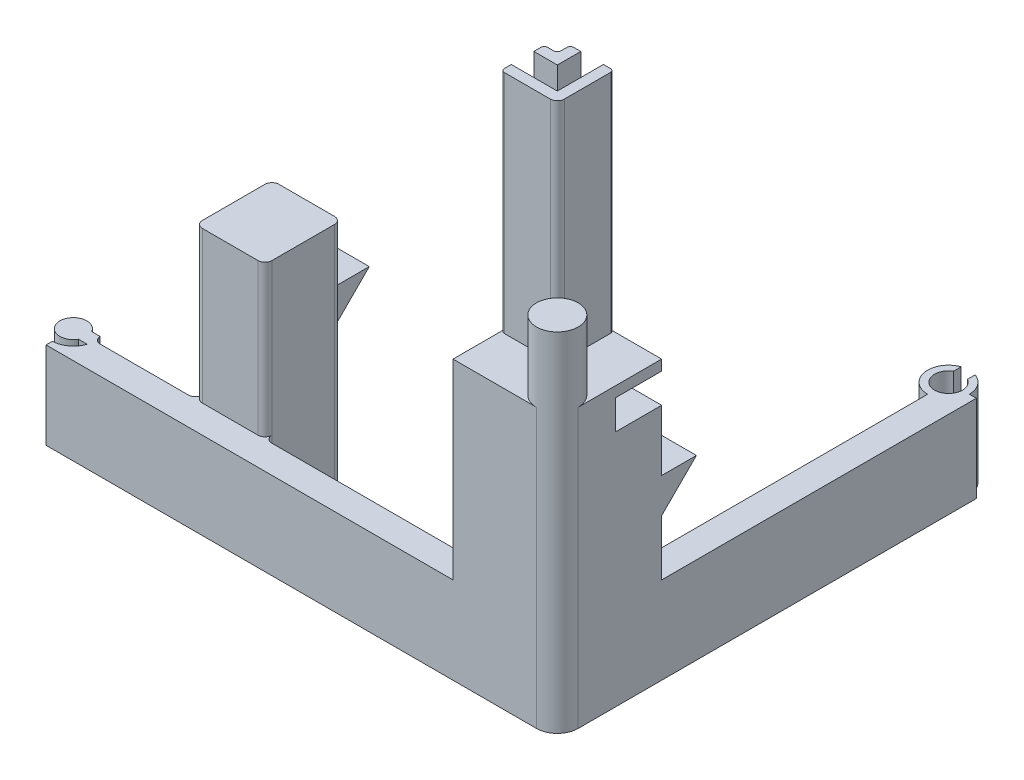
from build123d import *
from build123d.topology import SkipClean

# Parameters (mm, degrees)
SKETCH1_W                 = 30
SKETCH1_H                 = 30
BOSS_EXTRUDE1_DEPTH       = 80
SKETCH2_R                 = 6
BOSS_EXTRUDE2_DEPTH       = 20
CUT_EXTRUDE1_DEPTH        = 83.764726786
BOSS_EXTRUDE3_DEPTH       = 65
BOSS_EXTRUDE5_DEPTH       = 2
BOSS_EXTRUDE6_DEPTH       = 23
BOSS_EXTRUDE7_DEPTH       = 25
FILLET1_R                 = 2
SKETCH11_R                = 6.055782361
CUT_EXTRUDE2_DEPTH        = 2.125
CUT_EXTRUDE3_DEPTH        = 238.220050797
CUT_EXTRUDE3_DEPTH_BACK   = 238.220050797
SKETCH12_W                = 13.25
SKETCH12_H                = 8.5
FILLET2_R                 = 2
CUT_EXTRUDE4_REACH        = 195.24
SKETCH15_W                = 3.75
SKETCH15_H                = 3.75
FILLET3_R                 = 1
BOSS_EXTRUDE8_REACH       = 229.962
SKETCH16_W                = 20
SKETCH16_H                = 22
FILLET4_R                 = 2
FILLET5_R                 = 2
SKETCH17_W                = 15
SKETCH17_H                = 17
CUT_EXTRUDE5_DEPTH        = 66
CHAMFER1_SIZE             = 7
BOSS_EXTRUDE9_DEPTH       = 30
BOSS_EXTRUDE10_DEPTH      = 7.999995
BOSS_EXTRUDE10_DEPTH_BACK = 8.000005


with BuildPart() as part:
    # Sketch1 → Boss-Extrude1 (new body)
    with BuildSketch(Plane(origin=(0, 0, 0), x_dir=(1, 0, 0), z_dir=(0, 1, 0))):
        Rectangle(SKETCH1_W, SKETCH1_H)
    extrude(amount=BOSS_EXTRUDE1_DEPTH)

    # Sketch2 → Boss-Extrude2 (add)
    with BuildSketch(Plane(origin=(0, 80, 0), x_dir=(1, 0, 0), z_dir=(0, 1, 0))):
        with Locations(Location((9, -9, 0), (0, 0, 270))):
            Circle(SKETCH2_R)
    extrude(amount=BOSS_EXTRUDE2_DEPTH)

    # Sketch3 → Cut-Extrude1 (cut, through all)
    with BuildSketch(Plane(origin=(0, 80, 0), x_dir=(1, 0, 0), z_dir=(0, 1, 0))):
        with BuildLine():
            Line((9, -15), (15, -15))
            Line((15, -15), (15, -9))
            ThreePointArc((15, -9), (13.242640687, -13.242640687), (9, -15))
        make_face()
    extrude(amount=-CUT_EXTRUDE1_DEPTH, mode=Mode.SUBTRACT)

    # Sketch4 → Boss-Extrude3 (add)
    with BuildSketch(Plane(origin=(0, 80, 0), x_dir=(1, 0, 0), z_dir=(0, 1, 0))):
        Polygon((1.25, 11.25), (1.25, 15), (-1.75, 15), (-1.75, 11.25), (-1.75, 1.75), (-11.25, 1.75), (-15, 1.75), (-15, -1.25), (-11.25, -1.25), (1.25, -1.25), align=None)
        Polygon((-8.25, 11.25), (-8.25, 8.25), (-11.25, 8.25), (-15, 8.25), (-15, 11.25), (-11.25, 11.25), (-11.25, 15), (-8.25, 15), align=None)
    extrude(amount=BOSS_EXTRUDE3_DEPTH)

    # Sketch6 → Boss-Extrude5 (add)
    with BuildSketch(Plane.XZ):
        with BuildLine():
            Line((15, -15), (7, -15))
            Line((7, -15), (7, -99.5))
            ThreePointArc((7, -99.5), (2.757359313, -109.742640687), (13, -105.5))
            Line((13, -105.5), (15, -105.5))
            Line((15, -105.5), (15, -15))
        make_face()
    extrude(amount=-BOSS_EXTRUDE5_DEPTH)

    # Sketch7 → Boss-Extrude6 (add)
    with SkipClean():  # the faces are left unmerged after this step: merging them gives an invalid solid
        with BuildSketch(Plane(origin=(0, 2, 0), x_dir=(1, 0, 0), z_dir=(0, 1, 0))):
            with BuildLine():
                Line((9, 111.156854249), (9, 108.964101615))
                ThreePointArc((9, 108.964101615), (7, 101.5), (5, 108.964101615))
                Line((5, 108.964101615), (5, 111.156854249))
                ThreePointArc((5, 111.156854249), (1.086408642, 104.485388128), (7, 99.5))
                Line((7, 99.5), (7, 15))
                Line((7, 15), (15, 15))
                Line((15, 15), (15, 105.5))
                Line((15, 105.5), (13, 105.5))
                ThreePointArc((13, 105.5), (11.898979486, 108.964101615), (9, 111.156854249))
            make_face()
        extrude(amount=BOSS_EXTRUDE6_DEPTH)

    # Sketch9 → Boss-Extrude7 (add)
    with SkipClean():  # the faces are left unmerged after this step: merging them gives an invalid solid
        with BuildSketch(Plane.XZ):
            with BuildLine():
                Line((-15, 15), (-15, 7))
                Line((-15, 7), (-126.175, 7))
                ThreePointArc((-126.175, 7), (-126.252697751, 6.037536458), (-126.48377869, 5.1))
                Line((-126.48377869, 5.1), (-128.797778509, 5.1))
                ThreePointArc((-128.797778509, 5.1), (-136.05, 7), (-128.797778509, 8.9))
                Line((-128.797778509, 8.9), (-126.3, 8.9))
                ThreePointArc((-126.3, 8.9), (-128.491885554, 11.955834237), (-132.050001601, 13.173329766))
                Line((-132.050001601, 13.173329766), (-132.050001601, 15))
                Line((-132.050001601, 15), (-15, 15))
            make_face()
        extrude(amount=-BOSS_EXTRUDE7_DEPTH)

    # Fillet1
    fillet1_edges = [part.edges().sort_by_distance(p)[0] for p in [
        (-126.175, 12.5, 7),
    ]]
    fillet(fillet1_edges, radius=FILLET1_R)

    # Sketch11 → Cut-Extrude2 (cut)
    with SkipClean():  # the faces are left unmerged after this step: merging them gives an invalid solid
        with BuildSketch(Plane.XZ):
            with Locations((-132.175, 7)):
                Circle(SKETCH11_R)
        extrude(amount=-CUT_EXTRUDE2_DEPTH, mode=Mode.SUBTRACT)

    # Sketch12 → Cut-Extrude3 (cut, two sides: drawn at the far end of the back side and taken through both)
    with SkipClean():  # the faces are left unmerged after this step: merging them gives an invalid solid
        with BuildSketch(Plane(origin=(15, 0, 0), x_dir=(0, 0, -1), z_dir=(1, 0, 0)).offset(-CUT_EXTRUDE3_DEPTH_BACK)):
            with Locations((8.375, 72.75)):
                Rectangle(SKETCH12_W, SKETCH12_H)
        extrude(amount=CUT_EXTRUDE3_DEPTH + CUT_EXTRUDE3_DEPTH_BACK, mode=Mode.SUBTRACT)

    # Fillet2
    fillet2_edges = [part.edges().sort_by_distance(p)[0] for p in [
        (1.25, 112.5, 1.25),
    ]]
    fillet(fillet2_edges, radius=FILLET2_R)

    # Sketch15 → Cut-Extrude4 (cut, up to next)
    with BuildSketch(Plane(origin=(0, 80, 0), x_dir=(1, 0, 0), z_dir=(0, 1, 0)), mode=Mode.PRIVATE) as cut_extrude4_sk1:
        with Locations((-13.125, 13.125)):
            Rectangle(SKETCH15_W, SKETCH15_H)
    cut_extrude4_tool1 = extrude(cut_extrude4_sk1.sketch, amount=-CUT_EXTRUDE4_REACH, mode=Mode.PRIVATE) & part.part
    add(cut_extrude4_tool1.solids().sort_by_distance((-13.125, 80, -13.125))[0], mode=Mode.SUBTRACT)

    # Fillet3
    fillet3_edges = [part.edges().sort_by_distance(p)[0] for p in [
        (-11.25, 112.5, -15),
        (-11.25, 112.5, -11.25),
        (-15, 112.5, -11.25),
        (-15, 112.5, 1.25),
        (1.25, 112.5, -15),
    ]]
    fillet(fillet3_edges, radius=FILLET3_R)

    # Boss-Extrude8: up to this face of the body (flat: up to its plane)
    boss_extrude8_end = Plane(part.part.faces().sort_by_distance((0, 68.5, -8.375))[0])
    # Sketch16 → Boss-Extrude8 (add, up to the picked face)
    with BuildSketch(Plane.XZ, mode=Mode.PRIVATE) as boss_extrude8_sk1:
        with Locations((-87.071774981, -4)):
            Rectangle(SKETCH16_W, SKETCH16_H)
    boss_extrude8_tool1 = split(extrude(boss_extrude8_sk1.sketch, amount=-BOSS_EXTRUDE8_REACH, mode=Mode.PRIVATE), bisect_by=boss_extrude8_end, keep=Keep.BOTH, mode=Mode.PRIVATE)
    add(boss_extrude8_tool1.solids().sort_by(Axis((-87.071775, 0, -4), (0, 1, 0)))[0])

    # Fillet4
    fillet4_edges = [part.edges().sort_by_distance(p)[0] for p in [
        (-77.071774981, 12.5, 7),
        (-77.071774981, 34.25, -15),
        (-97.071774981, 34.25, -15),
        (-97.071774981, 12.5, 7),
    ]]
    fillet(fillet4_edges, radius=FILLET4_R)

    # Fillet5
    fillet5_edges = [part.edges().sort_by_distance(p)[0] for p in [
        (-77.071774981, 46.75, 7),
        (-97.071774981, 46.75, 7),
    ]]
    fillet(fillet5_edges, radius=FILLET5_R)

    # Sketch17 → Cut-Extrude5 (cut)
    with SkipClean():  # the faces are left unmerged after this step: merging them gives an invalid solid
        with BuildSketch(Plane.XZ):
            with Locations((-87.071774981, -4)):
                Rectangle(SKETCH17_W, SKETCH17_H)
        extrude(amount=-CUT_EXTRUDE5_DEPTH, mode=Mode.SUBTRACT)

    # Chamfer1
    chamfer1_edges = [part.edges().sort_by_distance(p)[0] for p in [
        (-94.571774981, 66, -4),
        (-87.071774981, 66, 4.5),
        (-79.571774981, 66, -4),
        (-87.071774981, 66, -12.5),
    ]]
    chamfer(chamfer1_edges, length=CHAMFER1_SIZE)

    # Sketch18 → Boss-Extrude9 (add)
    with SkipClean():  # the faces are left unmerged after this step: merging them gives an invalid solid
        with BuildSketch(Plane(origin=(15, 0, 0), x_dir=(0, 0, -1), z_dir=(1, 0, 0))):
            Polygon((15, 51), (15, 41), (25, 51), align=None)
        extrude(amount=-BOSS_EXTRUDE9_DEPTH)

    # Sketch19 → Boss-Extrude10 (add, two sides: drawn at the far end of the back side and taken through both)
    with SkipClean():  # the faces are left unmerged after this step: merging them gives an invalid solid
        with BuildSketch(Plane.ZY.offset(87.071774981).offset(-BOSS_EXTRUDE10_DEPTH_BACK)):
            Polygon((-15, 41), (-15, 51), (-25, 51), align=None)
        extrude(amount=BOSS_EXTRUDE10_DEPTH + BOSS_EXTRUDE10_DEPTH_BACK)


solid = part.part
